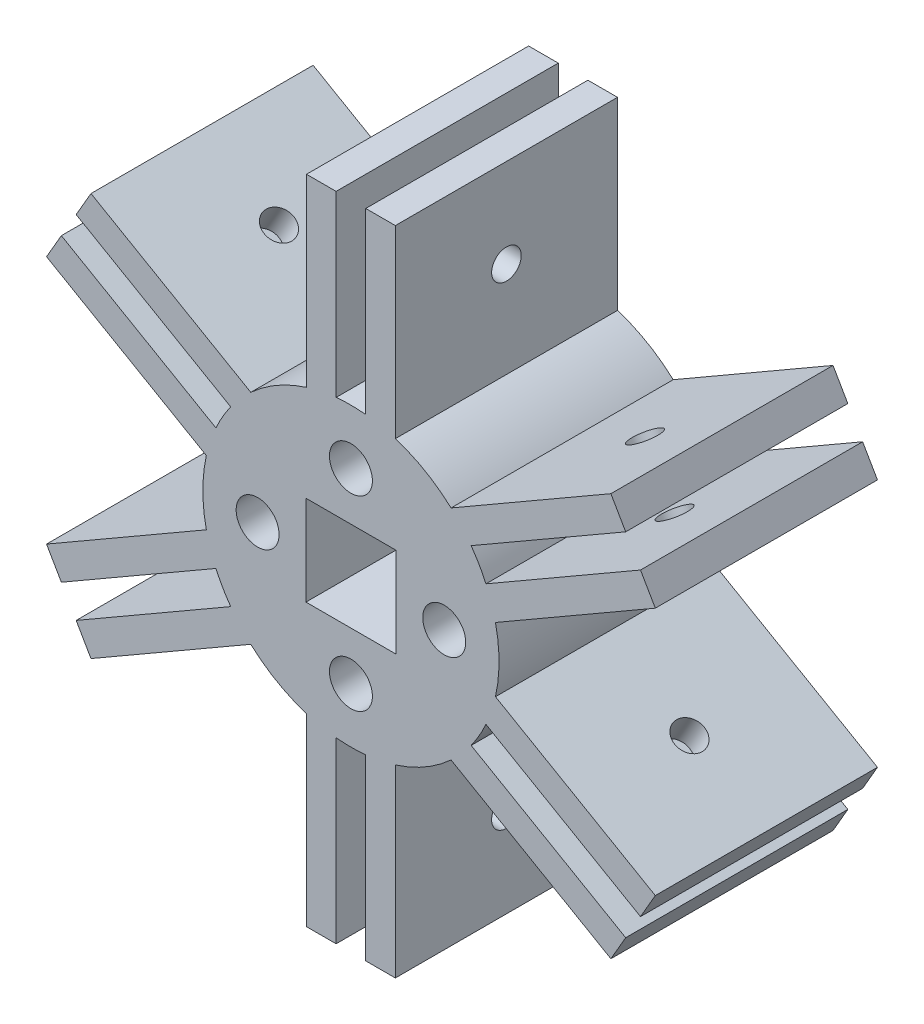
from build123d import *

# Parameters (mm, degrees)
SKETCH1_R           = 10
BOSS_EXTRUDE1_DEPTH = 7.5
SKETCH4_W           = 2
SKETCH4_H           = 22
BOSS_EXTRUDE3_DEPTH = 15
CIRPATTERN7_COUNT   = 6
SKETCH7_R           = 1
CUT_EXTRUDE2_DEPTH  = 10
CIRPATTERN9_COUNT   = 6
CUT_EXTRUDE3_REACH  = 35.636
SKETCH8_W           = 6.075
SKETCH8_H           = 6.075
SKETCH9_R           = 1.45
CUT_EXTRUDE4_DEPTH  = 10


with BuildPart() as part:
    # Sketch1 → Boss-Extrude1 (new, symmetric)
    with BuildSketch(Plane.XY):
        Circle(SKETCH1_R)
    extrude(amount=BOSS_EXTRUDE1_DEPTH, both=True)

    # Sketch4 → Boss-Extrude3 (add)
    with BuildSketch(Plane.XY.offset(7.5)):
        with Locations((-2, 11)):
            Rectangle(SKETCH4_W, SKETCH4_H)
        with Locations((2, 11)):
            Rectangle(SKETCH4_W, SKETCH4_H)
    boss_extrude3 = extrude(amount=-BOSS_EXTRUDE3_DEPTH)

    # CirPattern7: Boss-Extrude3 ×6 about axis
    cirpattern7_axis = Axis((0, 0, 0), (0, 0, 1))
    for i in range(1, CIRPATTERN7_COUNT):
        add(boss_extrude3.rotate(cirpattern7_axis, i * 360 / CIRPATTERN7_COUNT))

    # Sketch7 → Cut-Extrude2 (cut)
    with BuildSketch(Plane.ZY.offset(3)):
        with Locations((0, 16)):
            Circle(SKETCH7_R)
        with Locations((40, 16)):
            Circle(SKETCH7_R)
        with Locations((80, 16)):
            Circle(SKETCH7_R)
        with Locations((120, 16)):
            Circle(SKETCH7_R)
        with Locations((160, 16)):
            Circle(SKETCH7_R)
    cut_extrude2 = extrude(amount=-CUT_EXTRUDE2_DEPTH, mode=Mode.SUBTRACT)

    # CirPattern9: Cut-Extrude2 ×6 about axis
    cirpattern9_axis = Axis((0, 0, 0), (0, 0, 1))
    for i in range(1, CIRPATTERN9_COUNT):
        add(cut_extrude2.rotate(cirpattern9_axis, i * 360 / CIRPATTERN9_COUNT), mode=Mode.SUBTRACT)

    # Sketch8 → Cut-Extrude3 (cut, up to next)
    with BuildSketch(Plane.XY.offset(7.5), mode=Mode.PRIVATE) as cut_extrude3_sk1:
        Rectangle(SKETCH8_W, SKETCH8_H)
    cut_extrude3_tool1 = extrude(cut_extrude3_sk1.sketch, amount=-CUT_EXTRUDE3_REACH, mode=Mode.PRIVATE) & part.part
    add(cut_extrude3_tool1.solids().sort_by_distance((0, 0, 7.5))[0], mode=Mode.SUBTRACT)

    # Sketch9 → Cut-Extrude4 (cut)
    with BuildSketch(Plane.XY.offset(7.5)):
        with Locations((6.3, 0)):
            Circle(SKETCH9_R)
        with Locations((0, -6.3)):
            Circle(SKETCH9_R)
        with Locations((-6.3, 0)):
            Circle(SKETCH9_R)
        with Locations((0, 6.3)):
            Circle(SKETCH9_R)
    extrude(amount=-CUT_EXTRUDE4_DEPTH, mode=Mode.SUBTRACT)


solid = part.part
